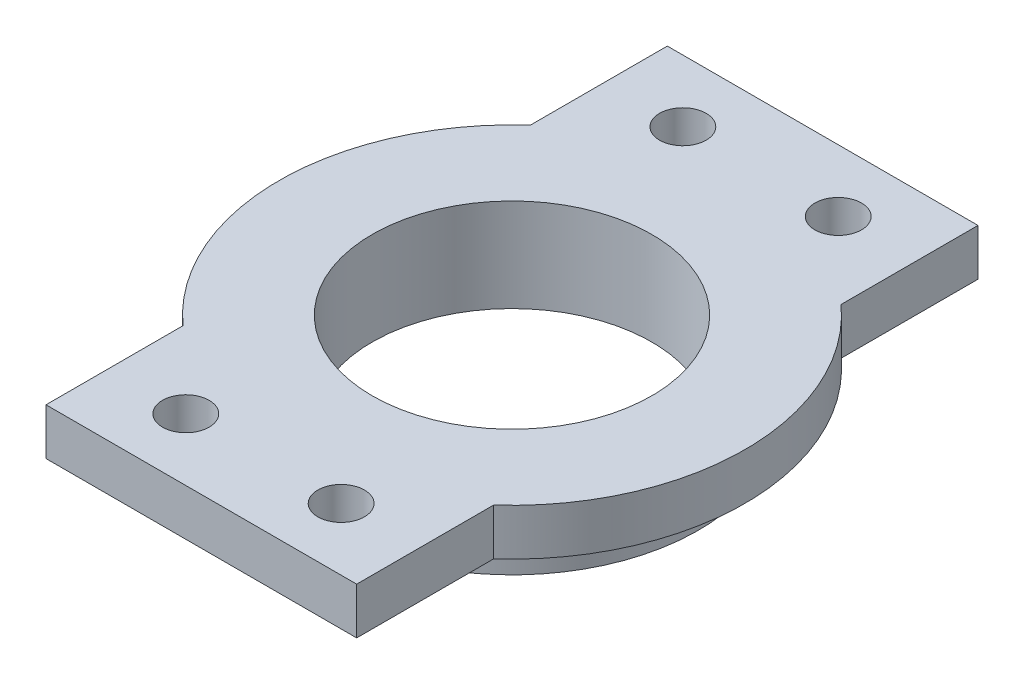
from build123d import *

# Parameters (mm, degrees)
SKETCH_1_R      = 12
SKETCH_1_R_2    = 9
EXTRUDE_1_DEPTH = 3
SKETCH_2_R      = 9
SKETCH_2_R_2    = 1.5
EXTRUDE_2_DEPTH = 3


with BuildPart() as part:
    # 草图1 → 凸台-拉伸1 (new body)
    with BuildSketch(Plane(origin=(0, 0, 0), x_dir=(1, 0, 0), z_dir=(0, 1, 0))):
        with Locations(Location((0, 0, 0), (0, 0, 270))):
            Circle(SKETCH_1_R)
        with Locations(Location((0, 0, 0), (0, 0, 270))):
            Circle(SKETCH_1_R_2, mode=Mode.SUBTRACT)
    extrude(amount=EXTRUDE_1_DEPTH)

    # 草图2 → 凸台-拉伸2 (add)
    with BuildSketch(Plane(origin=(0, 3, 0), x_dir=(1, 0, 0), z_dir=(0, 1, 0))):
        with BuildLine():
            Line((-10, -11.180339887), (-10, -20))
            Line((-10, -20), (10, -20))
            Line((10, -20), (10, -11.180339887))
            ThreePointArc((10, -11.180339887), (15, 0), (10, 11.180339887))
            Line((10, 11.180339887), (10, 20))
            Line((10, 20), (-10, 20))
            Line((-10, 20), (-10, 11.180339887))
            ThreePointArc((-10, 11.180339887), (-15, 0), (-10, -11.180339887))
        make_face()
        with Locations(Location((0, 0, 0), (0, 0, 270))):
            Circle(SKETCH_2_R, mode=Mode.SUBTRACT)
        with Locations(Location((-5, 16, 0), (0, 0, 270))):
            Circle(SKETCH_2_R_2, mode=Mode.SUBTRACT)
        with Locations(Location((5, 16, 0), (0, 0, 270))):
            Circle(SKETCH_2_R_2, mode=Mode.SUBTRACT)
        with Locations(Location((-5, -16, 0), (0, 0, 270))):
            Circle(SKETCH_2_R_2, mode=Mode.SUBTRACT)
        with Locations(Location((5, -16, 0), (0, 0, 270))):
            Circle(SKETCH_2_R_2, mode=Mode.SUBTRACT)
    extrude(amount=EXTRUDE_2_DEPTH)


solid = part.part
